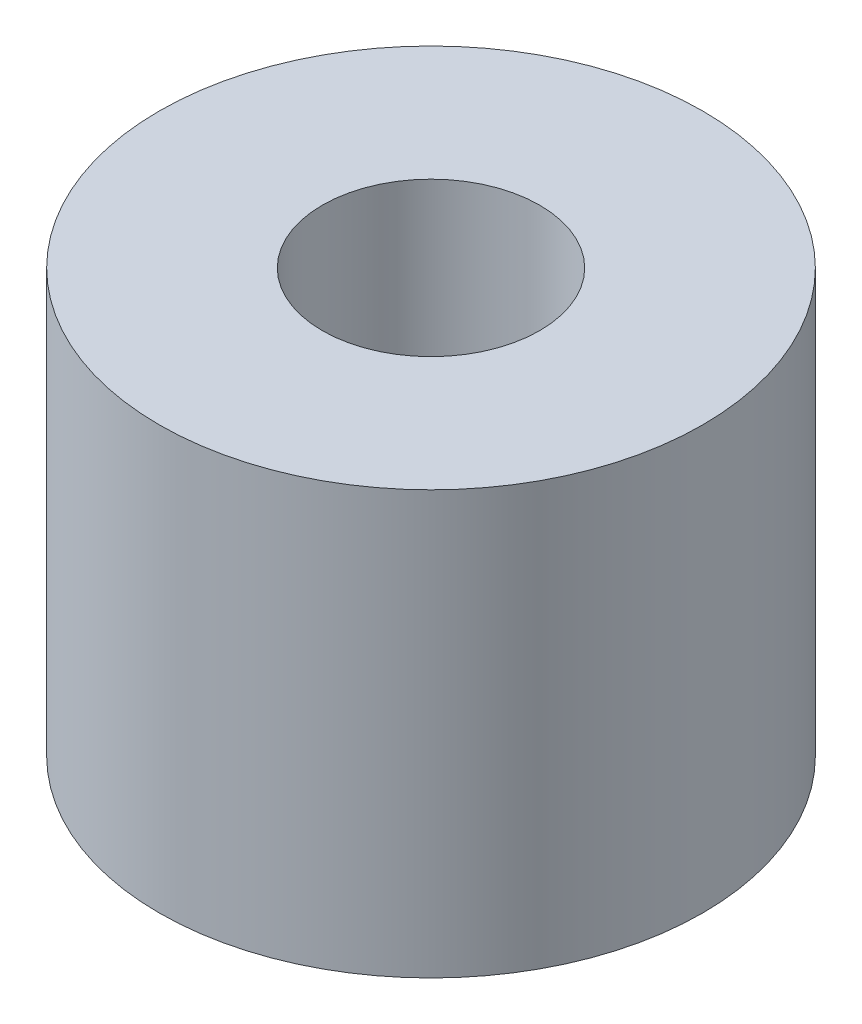
from build123d import *

# Parameters (mm, degrees)
CROQUIS1_R              = 4.5
CROQUIS1_R_2            = 1.8
SALIENTE_EXTRUIR1_DEPTH = 7


with BuildPart() as part:
    # Croquis1 → Saliente-Extruir1 (new body)
    with BuildSketch(Plane(origin=(0, 0, 0), x_dir=(1, 0, 0), z_dir=(0, 1, 0))):
        with Locations(Location((0, 0, 0), (0, 0, 270))):
            Circle(CROQUIS1_R)
        with Locations(Location((0, 0, 0), (0, 0, 270))):
            Circle(CROQUIS1_R_2, mode=Mode.SUBTRACT)
    extrude(amount=SALIENTE_EXTRUIR1_DEPTH)


solid = part.part
